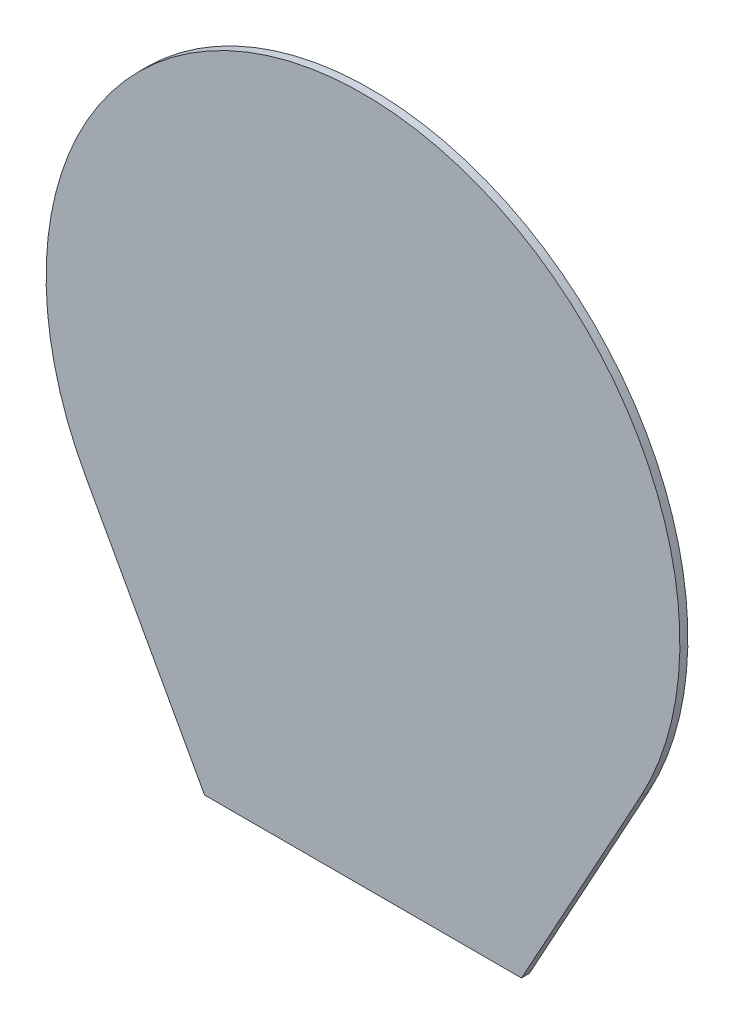
from build123d import *

# Parameters (mm, degrees)
BOSS_EXTRUDE1_DEPTH = 0.75438


with BuildPart() as part:
    # Sketch1 → Boss-Extrude1 (new body)
    with BuildSketch(Plane.XY):
        with BuildLine():
            Line((-26.292884648, -14.44590658), (-15, -35))
            Line((-15, -35), (-7.5, -35))
            Line((-7.5, -35), (15, -35))
            Line((15, -35), (26.292884648, -14.44590658))
            ThreePointArc((26.292884648, -14.44590658), (0, 30), (-26.292884648, -14.44590658))
        make_face()
    extrude(amount=BOSS_EXTRUDE1_DEPTH)


solid = part.part
